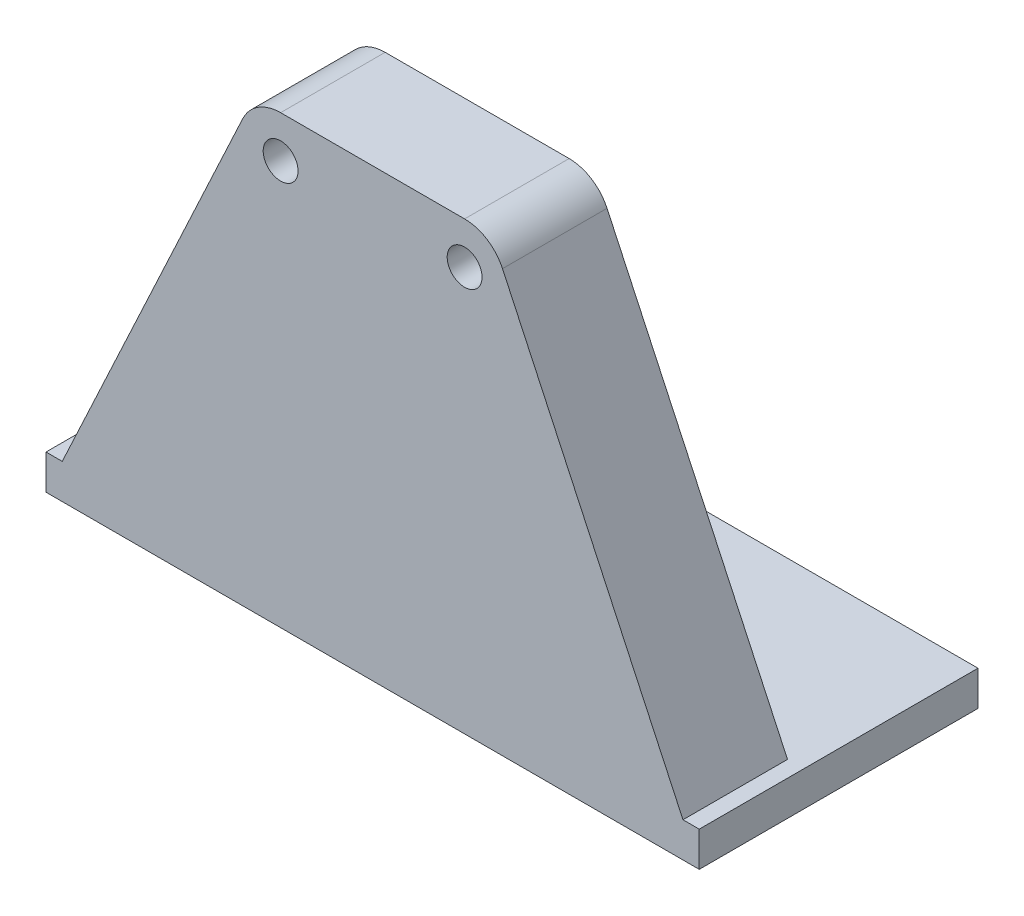
from build123d import *

# Parameters (mm, degrees)
SKETCH1_R           = 1.5875
BOSS_EXTRUDE1_DEPTH = 9.525
SKETCH2_W           = 59.519961842
SKETCH2_H           = 3.175
BOSS_EXTRUDE2_DEPTH = 25.4


with BuildPart() as part:
    # Sketch1 → Boss-Extrude1 (new body)
    with BuildSketch(Plane.XY):
        with BuildLine():
            Line((0, 0), (17.924948252, 38.440175577))
            ThreePointArc((17.924948252, 38.440175577), (19.330869413, 40.043321409), (21.377980921, 40.64))
            Line((21.377980921, 40.64), (38.141980921, 40.64))
            ThreePointArc((38.141980921, 40.64), (40.189092429, 40.043321409), (41.59501359, 38.440175577))
            Line((41.59501359, 38.440175577), (59.519961842, 0))
            Line((59.519961842, 0), (0, 0))
        make_face()
        with Locations((21.377980921, 36.83)):
            Circle(SKETCH1_R, mode=Mode.SUBTRACT)
        with Locations((38.141980921, 36.83)):
            Circle(SKETCH1_R, mode=Mode.SUBTRACT)
    extrude(amount=BOSS_EXTRUDE1_DEPTH)

    # Sketch2 → Boss-Extrude2 (add)
    with BuildSketch(Plane.XY.offset(9.525)):
        with Locations((29.759980921, 1.5875)):
            Rectangle(SKETCH2_W, SKETCH2_H)
    extrude(amount=-BOSS_EXTRUDE2_DEPTH)


solid = part.part
